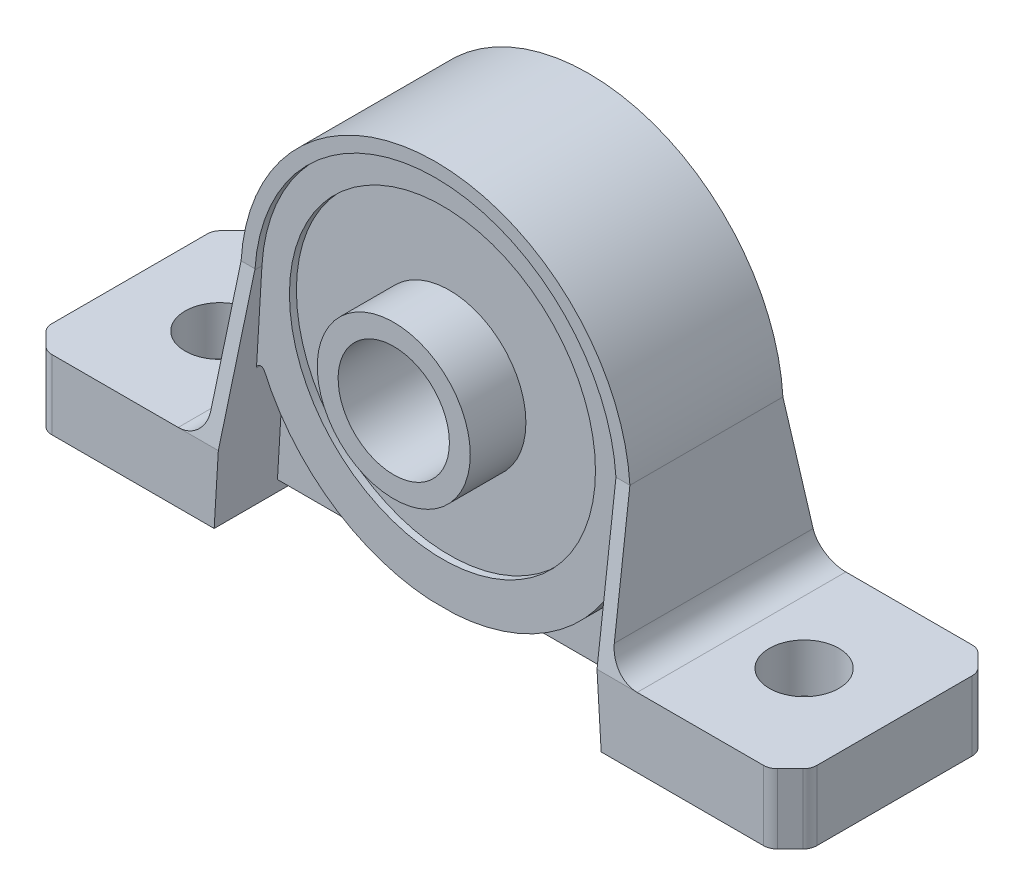
from build123d import *

# Parameters (mm, degrees)
CROQUIS1_R                 = 4
SALIENTE_EXTRUIR1_DEPTH    = 15
CROQUIS2_R                 = 11
CORTAR_EXTRUIR1_DEPTH      = 3
CROQUIS3_R                 = 5.5
CROQUIS3_R_2               = 4
SALIENTE_EXTRUIR2_DEPTH    = 4
CORTAR_EXTRUIR2_DEPTH      = 36.134373023
CORTAR_EXTRUIR2_DEPTH_BACK = 36.134373023
CROQUIS4_R                 = 2.5
CORTAR_EXTRUIR3_START      = -4.5
CORTAR_EXTRUIR3_DEPTH      = 4.5
CORTAR_EXTRUIR4_START      = -2.5
CROQUIS8_R                 = 5.5
CORTAR_EXTRUIR4_DEPTH      = 2.5
CORTAR_EXTRUIR5_DEPTH      = 34.684924933
CORTAR_EXTRUIR5_DEPTH_BACK = 34.684924933
CORTAR_EXTRUIR6_REACH      = 61.188
CORTAR_EXTRUIR7_DEPTH      = 5
CORTAR_EXTRUIR8_DEPTH      = 1.5
SALIENTE_EXTRUIR3_START    = 1
CROQUIS13_R                = 5.5
CROQUIS13_R_2              = 4
SALIENTE_EXTRUIR3_DEPTH    = 1
SCALE1_SCALE               = 2


with BuildPart() as part:
    # Croquis1 → Saliente-Extruir1 (new body)
    with BuildSketch(Plane.XY):
        with BuildLine():
            Line((27.5, -13.890204062), (-27.5, -13.890204062))
            Line((-27.5, -13.890204062), (-27.5, -8.890204062))
            Line((-27.5, -8.890204062), (-16.496411132, -8.890204062))
            ThreePointArc((-16.496411132, -8.890204062), (-15.125192899, -8.346143813), (-14.5, -7.009964621))
            Line((-14.5, -7.009964621), (-13.974877925, 1.743831875))
            ThreePointArc((-13.974877925, 1.743831875), (0, 14.905507967), (13.974877925, 1.743831875))
            Line((13.974877925, 1.743831875), (14.5, -7.009964621))
            ThreePointArc((14.5, -7.009964621), (15.125192899, -8.346143813), (16.496411132, -8.890204062))
            Line((16.496411132, -8.890204062), (27.5, -8.890204062))
            Line((27.5, -8.890204062), (27.5, -13.890204062))
        make_face()
        with Locations((0, 0.905507967)):
            Circle(CROQUIS1_R, mode=Mode.SUBTRACT)
    extrude(amount=SALIENTE_EXTRUIR1_DEPTH)

    # Croquis2 → Cortar-Extruir1 (cut)
    with BuildSketch(Plane.XY.offset(15)):
        with Locations((0, 0.905507967)):
            Circle(CROQUIS2_R)
    cortar_extruir1 = extrude(amount=-CORTAR_EXTRUIR1_DEPTH, mode=Mode.SUBTRACT)

    # Croquis3 → Saliente-Extruir2 (add)
    with BuildSketch(Plane.XY.offset(12)):
        with Locations((0, 0.905507967)):
            Circle(CROQUIS3_R)
        with Locations((0, 0.905507967)):
            Circle(CROQUIS3_R_2, mode=Mode.SUBTRACT)
    extrude(amount=SALIENTE_EXTRUIR2_DEPTH)

    # Croquis4 → Cortar-Extruir2 (cut, two sides: drawn at the far end of the back side and taken through both)
    with BuildSketch(Plane(origin=(0, 0, 0), x_dir=(1, 0, 0), z_dir=(0, 1, 0)).offset(-CORTAR_EXTRUIR2_DEPTH_BACK)):
        with Locations(Location((-21, -7.5, 0), (0, 0, 270))):
            Circle(CROQUIS4_R)
        with Locations(Location((21, -7.5, 0), (0, 0, 270))):
            Circle(CROQUIS4_R)
    extrude(amount=CORTAR_EXTRUIR2_DEPTH + CORTAR_EXTRUIR2_DEPTH_BACK, mode=Mode.SUBTRACT)

    # Simetría1: Cortar-Extruir1 across plane
    add(cortar_extruir1.mirror(Plane.XY.offset(7.5)), mode=Mode.SUBTRACT)

    # Croquis7 → Cortar-Extruir3 (cut)
    with BuildSketch(Plane.XY.offset(15).offset(CORTAR_EXTRUIR3_START)):
        with BuildLine():
            Line((-13.910933618, -13.890204062), (-13.370245715, -4.876924871))
            ThreePointArc((-13.370245715, -4.876924871), (-13.124159844, -4.599675432), (-12.796571792, -4.773202306))
            ThreePointArc((-12.796571792, -4.773202306), (0, -13.094492033), (12.796571792, -4.773202306))
            ThreePointArc((12.796571792, -4.773202306), (13.124159844, -4.599675432), (13.370245715, -4.876924871))
            Line((13.370245715, -4.876924871), (13.910933618, -13.890204062))
            Line((13.910933618, -13.890204062), (-13.910933618, -13.890204062))
        make_face()
    cortar_extruir3 = extrude(amount=CORTAR_EXTRUIR3_DEPTH, mode=Mode.SUBTRACT)

    # Croquis8 → Cortar-Extruir4 (cut)
    with BuildSketch(Plane.XY.offset(15).offset(CORTAR_EXTRUIR4_START)):
        with BuildLine():
            Line((-13.910933618, -13.890204062), (-12.976672359, 1.683951596))
            ThreePointArc((-12.976672359, 1.683951596), (0, 13.905507967), (12.976672359, 1.683951596))
            Line((12.976672359, 1.683951596), (13.910933618, -13.890204062))
            Line((13.910933618, -13.890204062), (-13.910933618, -13.890204062))
        make_face()
        with Locations((0, 0.905507967)):
            Circle(CROQUIS8_R, mode=Mode.SUBTRACT)
    cortar_extruir4 = extrude(amount=CORTAR_EXTRUIR4_DEPTH, mode=Mode.SUBTRACT)

    # Croquis9 → Cortar-Extruir5 (cut, two sides: drawn at the far end of the back side and taken through both)
    with BuildSketch(Plane.XY.offset(12.5).offset(-CORTAR_EXTRUIR5_DEPTH_BACK)):
        Polygon((13.910933618, -13.890204062), (13.861404459, -13.064551894), (-13.861404459, -13.064551894), (-13.910933618, -13.890204062), align=None)
    extrude(amount=CORTAR_EXTRUIR5_DEPTH + CORTAR_EXTRUIR5_DEPTH_BACK, mode=Mode.SUBTRACT)

    # Croquis10 → Cortar-Extruir6 (cut, up to next)
    with BuildSketch(Plane(origin=(27.5, 0, 0), x_dir=(0, 0, -1), z_dir=(1, 0, 0)), mode=Mode.PRIVATE) as cortar_extruir6_sk1:
        Polygon((-15, 15.98971015), (-13, 14.905507967), (-13, 1.743831875), (-15, -8.890204062), align=None)
    cortar_extruir6_tool1 = extrude(cortar_extruir6_sk1.sketch, amount=-CORTAR_EXTRUIR6_REACH, mode=Mode.PRIVATE) & part.part
    # Croquis10 → Cortar-Extruir6 (cut, up to next)
    with BuildSketch(Plane(origin=(27.5, 0, 0), x_dir=(0, 0, -1), z_dir=(1, 0, 0)), mode=Mode.PRIVATE) as cortar_extruir6_sk2:
        Polygon((-2, 14.905507967), (0, 15.98971015), (0, -8.890204062), (-2, 1.743831875), align=None)
    cortar_extruir6_tool2 = extrude(cortar_extruir6_sk2.sketch, amount=-CORTAR_EXTRUIR6_REACH, mode=Mode.PRIVATE) & part.part
    add(cortar_extruir6_tool1.solids().sort_by_distance((27.5, 5.692069, 14.102679))[0], mode=Mode.SUBTRACT)
    add(cortar_extruir6_tool2.solids().sort_by_distance((27.5, 5.692069, 0.897321))[0], mode=Mode.SUBTRACT)

    # Croquis11 → Cortar-Extruir7 (cut)
    with BuildSketch(Plane.XZ.offset(13.890204062)):
        with BuildLine():
            Line((-26.292893219, 14.707106781), (-27.207106781, 13.792893219))
            ThreePointArc((-27.207106781, 13.792893219), (-27.423879533, 13.46846987), (-27.5, 13.085786438))
            Line((-27.5, 13.085786438), (-27.5, 1.914213562))
            ThreePointArc((-27.5, 1.914213562), (-27.423879533, 1.53153013), (-27.207106781, 1.207106781))
            Line((-27.207106781, 1.207106781), (-26.292893219, 0.292893219))
            ThreePointArc((-26.292893219, 0.292893219), (-25.96846987, 0.076120467), (-25.585786438, 0))
            Line((-25.585786438, 0), (-15.540514777, 0))
            Line((-15.540514777, 0), (-15.540514777, -5.530731653))
            Line((-15.540514777, -5.530731653), (-33.970258, -5.530731653))
            Line((-33.970258, -5.530731653), (-33.970258, 16.269467594))
            Line((-33.970258, 16.269467594), (-15.540514777, 16.269467594))
            Line((-15.540514777, 16.269467594), (-15.540514777, 15))
            Line((-15.540514777, 15), (-25.585786438, 15))
            ThreePointArc((-25.585786438, 15), (-25.96846987, 14.923879533), (-26.292893219, 14.707106781))
        make_face()
    cortar_extruir7 = extrude(amount=-CORTAR_EXTRUIR7_DEPTH, mode=Mode.SUBTRACT)

    # Croquis12 → Cortar-Extruir8 (cut)
    with BuildSketch(Plane.XZ.offset(13.890204062)):
        with BuildLine():
            Line((-25, 13.5), (-16.410933618, 13.5))
            ThreePointArc((-16.410933618, 13.5), (-15.703826837, 13.207106781), (-15.410933618, 12.5))
            Line((-15.410933618, 12.5), (-15.410933618, 2.5))
            ThreePointArc((-15.410933618, 2.5), (-15.703826837, 1.792893219), (-16.410933618, 1.5))
            Line((-16.410933618, 1.5), (-25, 1.5))
            ThreePointArc((-25, 1.5), (-25.707106781, 1.792893219), (-26, 2.5))
            Line((-26, 2.5), (-26, 12.5))
            ThreePointArc((-26, 12.5), (-25.707106781, 13.207106781), (-25, 13.5))
        make_face()
    cortar_extruir8 = extrude(amount=-CORTAR_EXTRUIR8_DEPTH, mode=Mode.SUBTRACT)

    # Simetría2: Cortar-Extruir7, Cortar-Extruir8 across plane
    add(cortar_extruir7.mirror(Plane(origin=(0, 0, 0), x_dir=(0, 0, 1), z_dir=(1, 0, 0))), mode=Mode.SUBTRACT)
    add(cortar_extruir8.mirror(Plane(origin=(0, 0, 0), x_dir=(0, 0, 1), z_dir=(1, 0, 0))), mode=Mode.SUBTRACT)

    # Simetría4: Cortar-Extruir3, Cortar-Extruir4 across plane
    add(cortar_extruir3.mirror(Plane.XY.offset(7.5)), mode=Mode.SUBTRACT)
    add(cortar_extruir4.mirror(Plane.XY.offset(7.5)), mode=Mode.SUBTRACT)

    # Croquis13 → Saliente-Extruir3 (add)
    with BuildSketch(Plane(origin=(0, 0, 3), x_dir=(-1, 0, 0), z_dir=(0, 0, -1)).offset(SALIENTE_EXTRUIR3_START)):
        with Locations(Location((0, 0.905507967, 0), (0, 0, 180))):
            Circle(CROQUIS13_R)
        with Locations(Location((0, 0.905507967, 0), (0, 0, 270))):
            Circle(CROQUIS13_R_2, mode=Mode.SUBTRACT)
    extrude(amount=-SALIENTE_EXTRUIR3_DEPTH)


with BuildPart() as part_1:
    # Scale1: scaled about (0, -2.204708481, 7.62083442)
    add(part.part.scale(SCALE1_SCALE).moved(Location((0, 2.204708481, -7.62083442))))


solid = part_1.part
